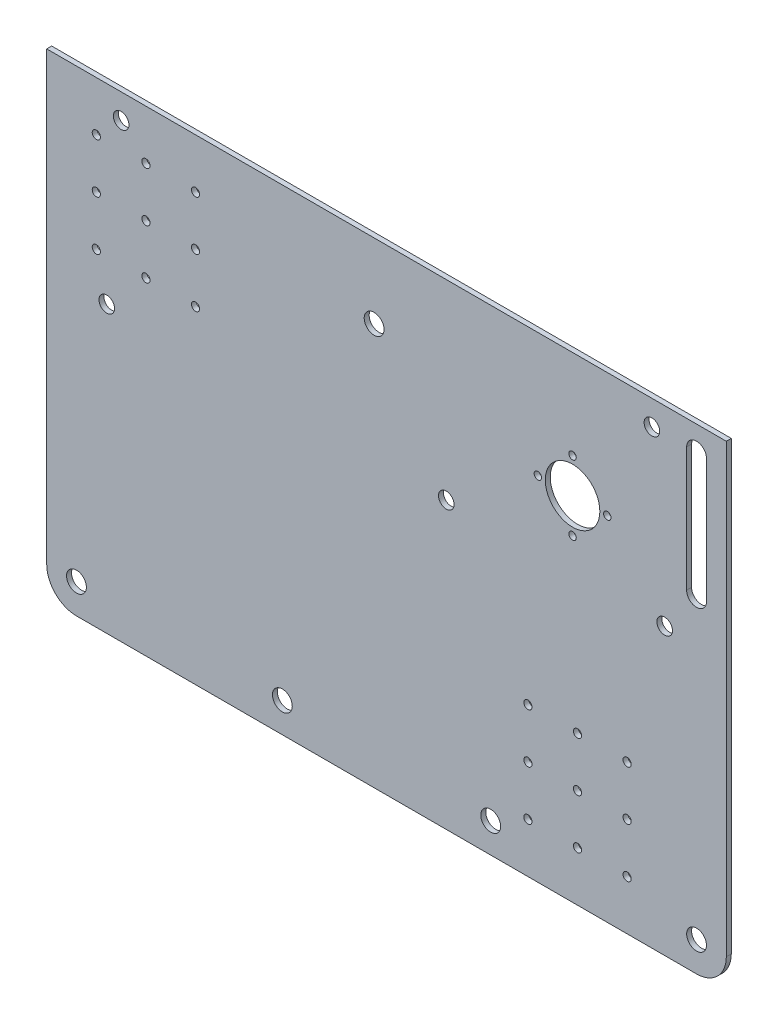
from build123d import *

# Parameters (mm, degrees)
SKETCH1_R           = 4
SKETCH1_R_2         = 1.65
SKETCH1_R_3         = 3.15
SKETCH1_R_4         = 1.5
SKETCH1_R_5         = 11
BOSS_EXTRUDE1_DEPTH = 2


with BuildPart() as part:
    # Sketch1 → Boss-Extrude1 (new body)
    with BuildSketch(Plane.XY):
        with BuildLine():
            ThreePointArc((-137, 0), (-133.485281374, -8.485281374), (-125, -12))
            Line((-125, -12), (125, -12))
            ThreePointArc((125, -12), (133.485281374, -8.485281374), (137, 0))
            Line((137, 0), (137, 180))
            Line((137, 180), (-53.998245329, 180))
            Line((-53.998245329, 180), (-137, 180))
            Line((-137, 180), (-137, 0))
        make_face()
        with Locations((-125, 0)):
            Circle(SKETCH1_R, mode=Mode.SUBTRACT)
        with Locations((-42, 0)):
            Circle(SKETCH1_R, mode=Mode.SUBTRACT)
        with Locations((42, 0)):
            Circle(SKETCH1_R, mode=Mode.SUBTRACT)
        with Locations((57, 8)):
            Circle(SKETCH1_R_2, mode=Mode.SUBTRACT)
        with Locations((57, 28)):
            Circle(SKETCH1_R_2, mode=Mode.SUBTRACT)
        with Locations((77, 8)):
            Circle(SKETCH1_R_2, mode=Mode.SUBTRACT)
        with Locations((97, 8)):
            Circle(SKETCH1_R_2, mode=Mode.SUBTRACT)
        with Locations((125, 0)):
            Circle(SKETCH1_R, mode=Mode.SUBTRACT)
        with Locations((77, 28)):
            Circle(SKETCH1_R_2, mode=Mode.SUBTRACT)
        with Locations((97, 28)):
            Circle(SKETCH1_R_2, mode=Mode.SUBTRACT)
        with Locations((57, 48)):
            Circle(SKETCH1_R_2, mode=Mode.SUBTRACT)
        with Locations((77, 48)):
            Circle(SKETCH1_R_2, mode=Mode.SUBTRACT)
        with Locations((97, 48)):
            Circle(SKETCH1_R_2, mode=Mode.SUBTRACT)
        with Locations((-112.78833811, 103)):
            Circle(SKETCH1_R_3, mode=Mode.SUBTRACT)
        with Locations((-117, 120)):
            Circle(SKETCH1_R_2, mode=Mode.SUBTRACT)
        with Locations((-97, 120)):
            Circle(SKETCH1_R_2, mode=Mode.SUBTRACT)
        with Locations((-77, 120)):
            Circle(SKETCH1_R_2, mode=Mode.SUBTRACT)
        with Locations((-117, 140)):
            Circle(SKETCH1_R_2, mode=Mode.SUBTRACT)
        with Locations((-97, 140)):
            Circle(SKETCH1_R_2, mode=Mode.SUBTRACT)
        with Locations((-77, 140)):
            Circle(SKETCH1_R_2, mode=Mode.SUBTRACT)
        with Locations((-117, 160)):
            Circle(SKETCH1_R_2, mode=Mode.SUBTRACT)
        with Locations((-107, 170)):
            Circle(SKETCH1_R_3, mode=Mode.SUBTRACT)
        with Locations((-97, 160)):
            Circle(SKETCH1_R_2, mode=Mode.SUBTRACT)
        with Locations((-77, 160)):
            Circle(SKETCH1_R_2, mode=Mode.SUBTRACT)
        with Locations((-5, 150)):
            Circle(SKETCH1_R, mode=Mode.SUBTRACT)
        with Locations((24.097224397, 103)):
            Circle(SKETCH1_R_3, mode=Mode.SUBTRACT)
        with Locations((61, 130)):
            Circle(SKETCH1_R_4, mode=Mode.SUBTRACT)
        with Locations((112.15381179, 103)):
            Circle(SKETCH1_R_3, mode=Mode.SUBTRACT)
        with Locations((75, 116)):
            Circle(SKETCH1_R_4, mode=Mode.SUBTRACT)
        with Locations((75, 130)):
            Circle(SKETCH1_R_5, mode=Mode.SUBTRACT)
        with Locations((89, 130)):
            Circle(SKETCH1_R_4, mode=Mode.SUBTRACT)
        with Locations((75, 144)):
            Circle(SKETCH1_R_4, mode=Mode.SUBTRACT)
        with BuildLine():
            ThreePointArc((129, 120), (125, 116), (121, 120))
            Line((121, 120), (121, 170))
            ThreePointArc((121, 170), (125, 174), (129, 170))
            Line((129, 170), (129, 120))
        make_face(mode=Mode.SUBTRACT)
        with Locations((107, 170)):
            Circle(SKETCH1_R_3, mode=Mode.SUBTRACT)
    extrude(amount=BOSS_EXTRUDE1_DEPTH)


solid = part.part
